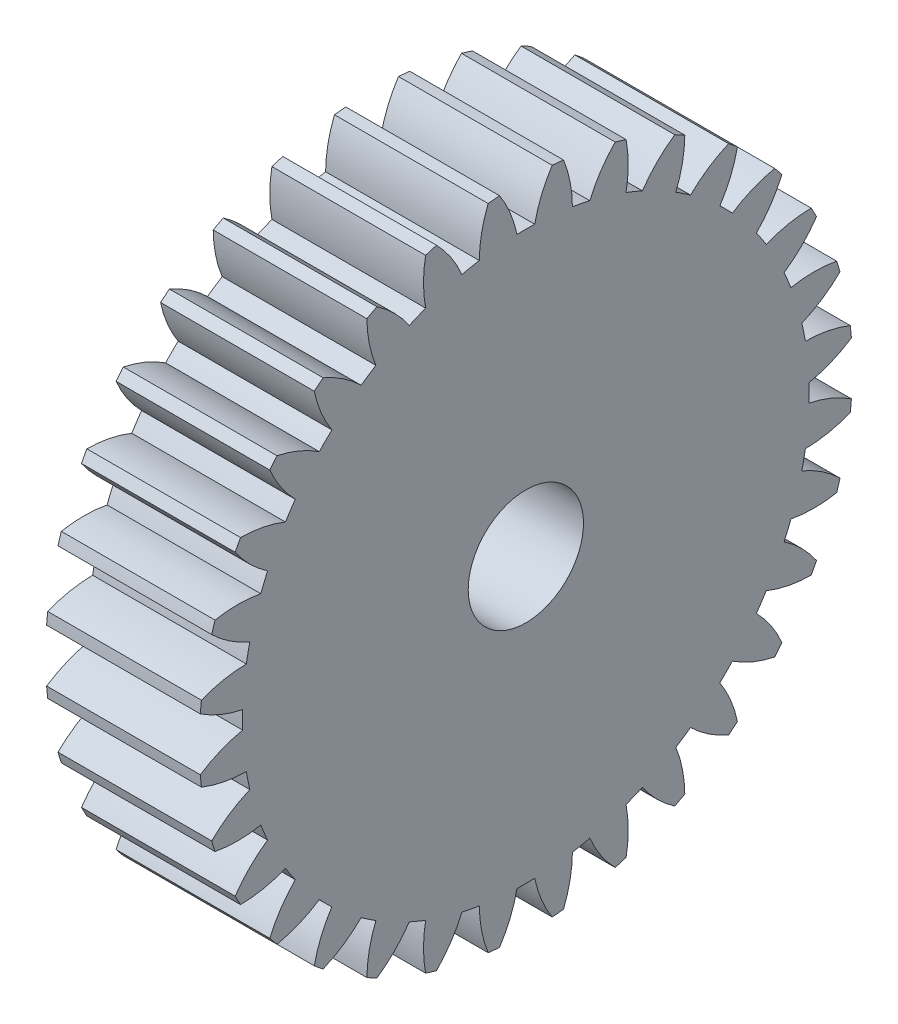
from build123d import *

# Parameters (mm, degrees)
BASPROSKE_W     = 4
BASPROSKE_H     = 8.5
TOOTHCUT_DEPTH  = 13.668859459
TEETHCUTS_COUNT = 32
TEETHCUTS_ANGLE = 348.75
BORSKE_R        = 1.5
BORE_DEPTH      = 50.0000508


with BuildPart() as part:
    # BasProSke → Base-Revolve (revolve)
    with BuildSketch(Plane(origin=(0, 0, 0), x_dir=(1, 0, 0), z_dir=(0, 1, 0)), mode=Mode.PRIVATE) as base_revolve_sk:
        with Locations((2, 4.25)):
            Rectangle(BASPROSKE_W, BASPROSKE_H)
    revolve(base_revolve_sk.sketch.rotate(Axis((-10, 0, 0), (1, 0, 0)), 180), axis=Axis((-10, 0, 0), (1, 0, 0)))

    # TooCutSke → ToothCut (cut, through all)
    with BuildSketch(Plane(origin=(0, 0, 0), x_dir=(0, 0, -1), z_dir=(1, 0, 0))):
        with BuildLine():
            ThreePointArc((0.230915662, 7.370383569), (0, 7.374), (-0.230915662, 7.370383569))
            ThreePointArc((-0.230915662, 7.370383569), (-0.411960263, 7.95607799), (-0.701370671, 8.496500712))
            ThreePointArc((-0.701370671, 8.496500712), (0, 8.5254), (0.701370671, 8.496500712))
            ThreePointArc((0.701370671, 8.496500712), (0.411960263, 7.95607799), (0.230915662, 7.370383569))
        make_face()
    toothcut = extrude(amount=TOOTHCUT_DEPTH, mode=Mode.SUBTRACT)

    # TeethCuts: ToothCut ×32 about axis
    teethcuts_axis = Axis((-10, 0, 0), (1, 0, 0))
    for i in range(1, TEETHCUTS_COUNT):
        add(toothcut.rotate(teethcuts_axis, i * TEETHCUTS_ANGLE / (TEETHCUTS_COUNT - 1)), mode=Mode.SUBTRACT)

    # BorSke → Bore (cut, symmetric)
    with BuildSketch(Plane(origin=(0, 0, 0), x_dir=(0, 0, -1), z_dir=(1, 0, 0))):
        with Locations(Location((0, 0, 0), (0, 0, 180))):
            Circle(BORSKE_R)
    extrude(amount=BORE_DEPTH, both=True, mode=Mode.SUBTRACT)


solid = part.part
